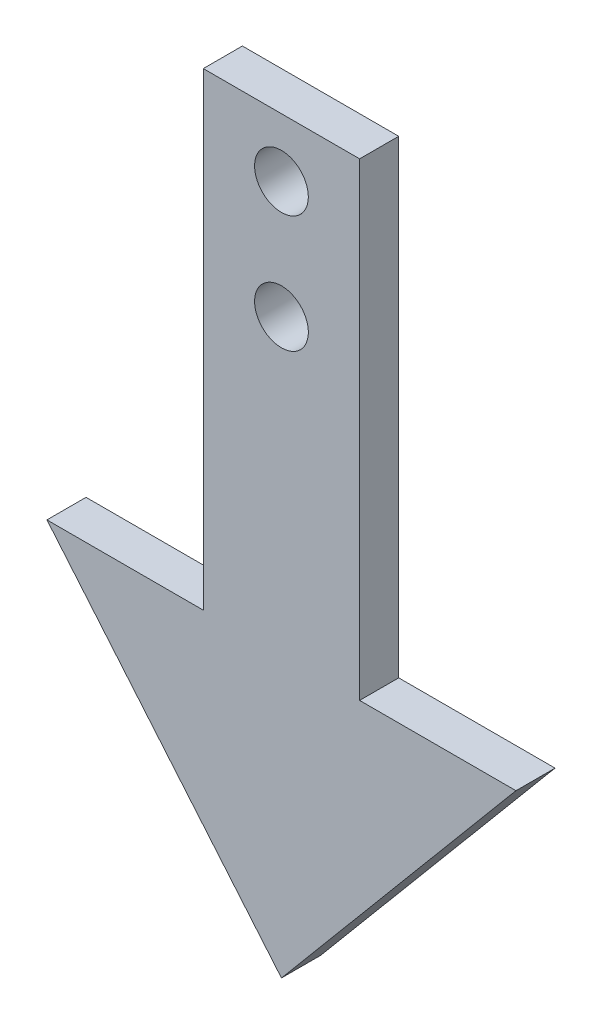
from build123d import *

# Parameters (mm, degrees)
BOSS_EXTRUDE1_DEPTH = 3.175
SKETCH2_R           = 2.1828125
CUT_EXTRUDE2_DEPTH  = 47.003133364


with BuildPart() as part:
    # Sketch1 → Boss-Extrude1 (new body)
    with BuildSketch(Plane.XY):
        Polygon((-6.35, -19.05), (-19.05, -19.05), (0, -41.752905939), (19.05, -19.05), (6.35, -19.05), (6.35, 19.05), (-6.35, 19.05), align=None)
    extrude(amount=BOSS_EXTRUDE1_DEPTH)

    # Sketch2 → Cut-Extrude2 (cut, through all)
    with BuildSketch(Plane.XY.offset(3.175)):
        with Locations((0, 14.2875)):
            Circle(SKETCH2_R)
        with Locations(Location((0, 4.7625, 0), (0, 0, 180))):
            Circle(SKETCH2_R)
    extrude(amount=-CUT_EXTRUDE2_DEPTH, mode=Mode.SUBTRACT)


solid = part.part
